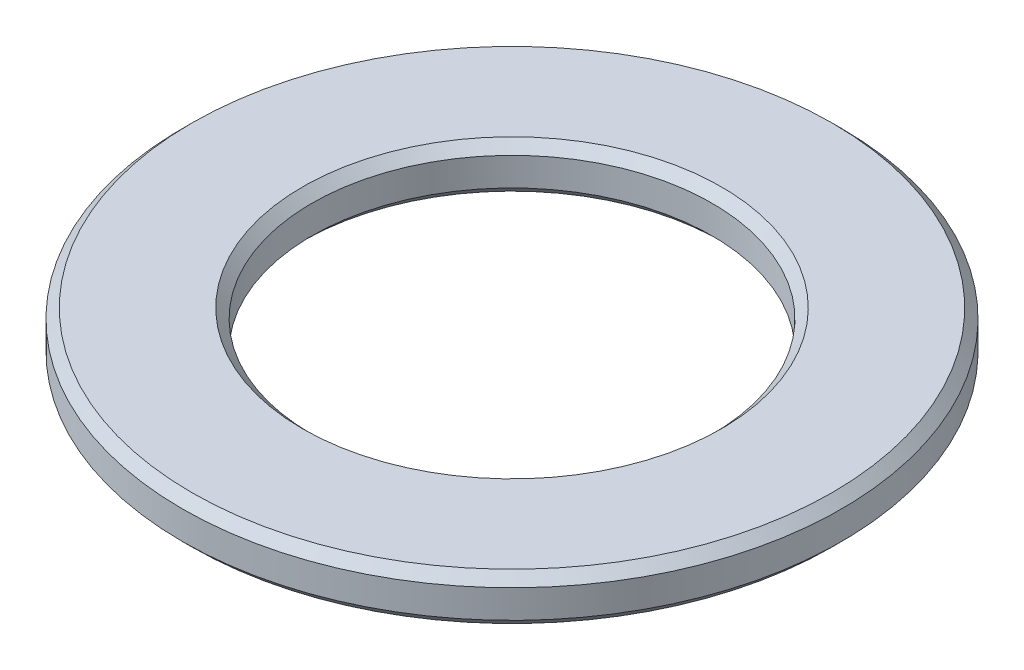
from build123d import *

# Parameters (mm, degrees)
SKETCH1_R           = 7
SKETCH1_R_2         = 4.25
BOSS_EXTRUDE1_DEPTH = 1
CHAMFER1_SIZE       = 0.2


with BuildPart() as part:
    # Sketch1 → Boss-Extrude1 (new body)
    with BuildSketch(Plane(origin=(0, 0, 0), x_dir=(1, 0, 0), z_dir=(0, 1, 0))):
        Circle(SKETCH1_R)
        Circle(SKETCH1_R_2, mode=Mode.SUBTRACT)
    extrude(amount=BOSS_EXTRUDE1_DEPTH)

    # Chamfer1
    chamfer1_edges = [part.edges().sort_by_distance(p)[0] for p in [
        (-4.25, 0, 0),
        (-7, 0, 0),
        (-4.25, 1, 0),
        (-7, 1, 0),
    ]]
    chamfer(chamfer1_edges, length=CHAMFER1_SIZE)


solid = part.part
